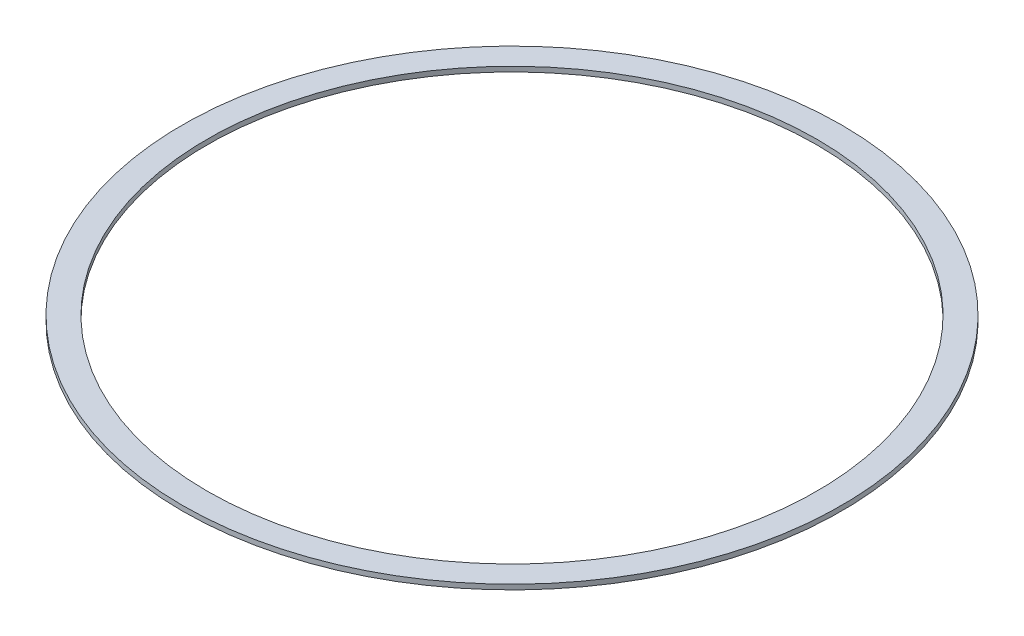
from build123d import *

# Parameters (mm, degrees)
SKETCH1_R           = 200
SKETCH1_R_2         = 185
BOSS_EXTRUDE1_DEPTH = 1.5


with BuildPart() as part:
    # Sketch1 → Boss-Extrude1 (new, symmetric)
    with BuildSketch(Plane(origin=(0, 0, 0), x_dir=(1, 0, 0), z_dir=(0, 1, 0))):
        with Locations(Location((0, 0, 0), (0, 0, 270))):
            Circle(SKETCH1_R)
        with Locations(Location((0, 0, 0), (0, 0, 270))):
            Circle(SKETCH1_R_2, mode=Mode.SUBTRACT)
    extrude(amount=BOSS_EXTRUDE1_DEPTH, both=True)


solid = part.part
